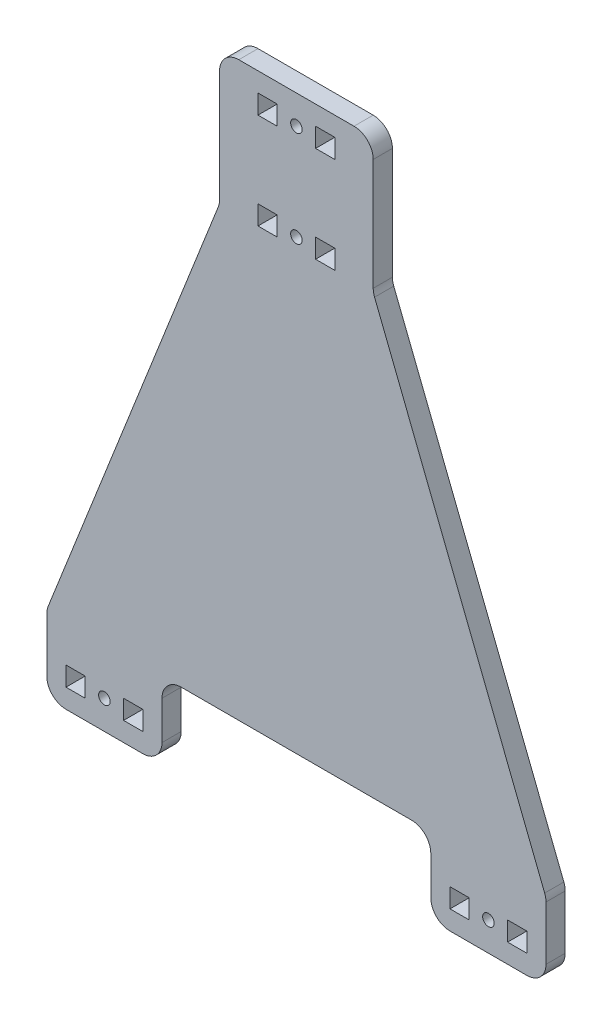
from build123d import *

# Parameters (mm, degrees)
SKETCH1_R           = 1.5
SKETCH1_W           = 5
SKETCH1_H           = 5
BOSS_EXTRUDE1_DEPTH = 5
FILLET1_R           = 5


with BuildPart() as part:
    # Sketch1 → Boss-Extrude1 (new body)
    with BuildSketch(Plane.XY):
        Polygon((-65, -10), (-35, -10), (-35, 10), (35, 10), (35, -10), (65, -10), (65, 10), (20, 124), (20, 159), (-20, 159), (-20, 124), (-65, 10), align=None)
        with Locations((50, -2.5)):
            Circle(SKETCH1_R, mode=Mode.SUBTRACT)
        with Locations((-50, -2.5)):
            Circle(SKETCH1_R, mode=Mode.SUBTRACT)
        with Locations((0, 126.5)):
            Circle(SKETCH1_R, mode=Mode.SUBTRACT)
        with Locations((0, 151.5)):
            Circle(SKETCH1_R, mode=Mode.SUBTRACT)
        with Locations((42.5, -2.5)):
            Rectangle(SKETCH1_W, SKETCH1_H, mode=Mode.SUBTRACT)
        with Locations((57.5, -2.5)):
            Rectangle(SKETCH1_W, SKETCH1_H, mode=Mode.SUBTRACT)
        with Locations((-57.5, -2.5)):
            Rectangle(SKETCH1_W, SKETCH1_H, mode=Mode.SUBTRACT)
        with Locations((-42.5, -2.5)):
            Rectangle(SKETCH1_W, SKETCH1_H, mode=Mode.SUBTRACT)
        with Locations((-7.5, 126.5)):
            Rectangle(SKETCH1_W, SKETCH1_H, mode=Mode.SUBTRACT)
        with Locations((7.5, 126.5)):
            Rectangle(SKETCH1_W, SKETCH1_H, mode=Mode.SUBTRACT)
        with Locations((-7.5, 151.5)):
            Rectangle(SKETCH1_W, SKETCH1_H, mode=Mode.SUBTRACT)
        with Locations((7.5, 151.5)):
            Rectangle(SKETCH1_W, SKETCH1_H, mode=Mode.SUBTRACT)
    extrude(amount=BOSS_EXTRUDE1_DEPTH)

    # Fillet1
    fillet1_edges = [part.edges().sort_by_distance(p)[0] for p in [
        (-65, 10, 2.5),
        (-20, 124, 2.5),
        (-20, 159, 2.5),
        (20, 159, 2.5),
        (20, 124, 2.5),
        (65, 10, 2.5),
        (65, -10, 2.5),
        (35, -10, 2.5),
        (35, 10, 2.5),
        (-35, 10, 2.5),
        (-35, -10, 2.5),
        (-65, -10, 2.5),
    ]]
    fillet(fillet1_edges, radius=FILLET1_R)


solid = part.part
